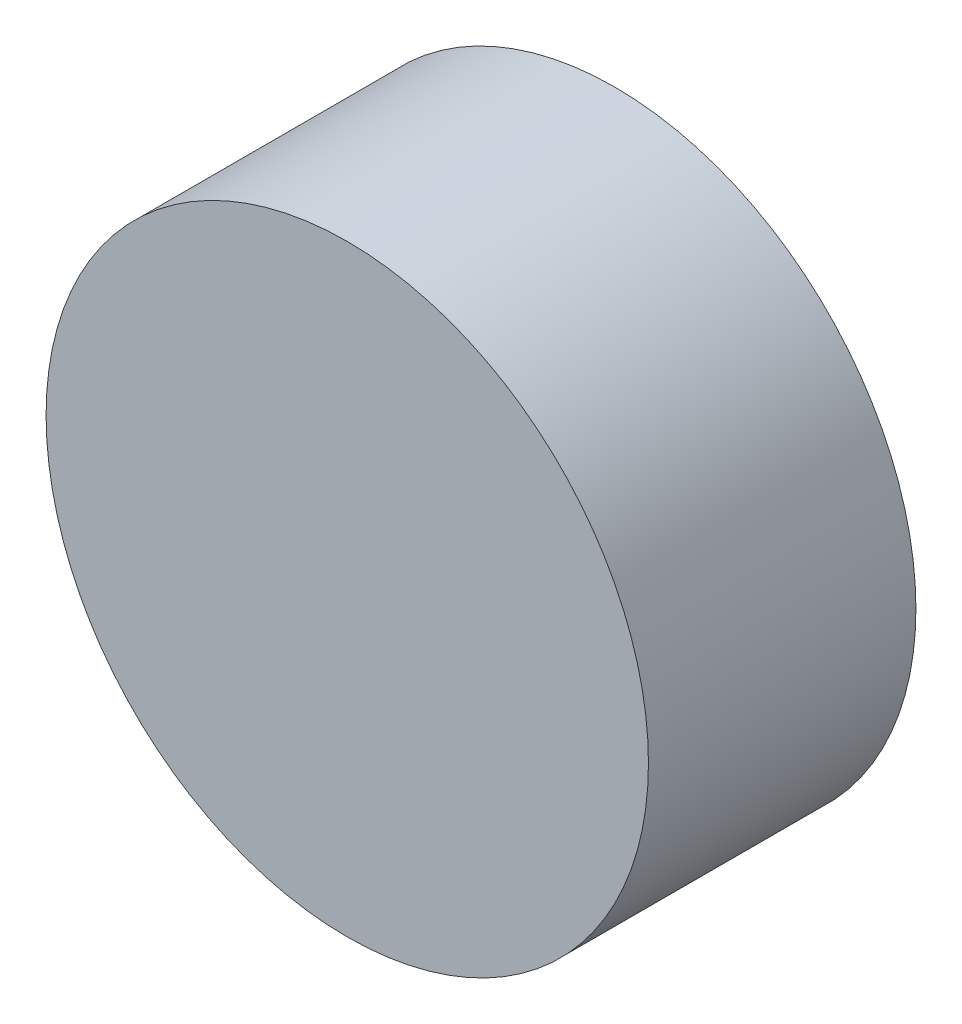
from build123d import *

# Parameters (mm, degrees)
SKETCH1_R           = 1.25
BOSS_EXTRUDE1_DEPTH = 1.11


with BuildPart() as part:
    # Sketch1 → Boss-Extrude1 (new body)
    with BuildSketch(Plane.XY):
        Circle(SKETCH1_R)
    extrude(amount=BOSS_EXTRUDE1_DEPTH)


solid = part.part
